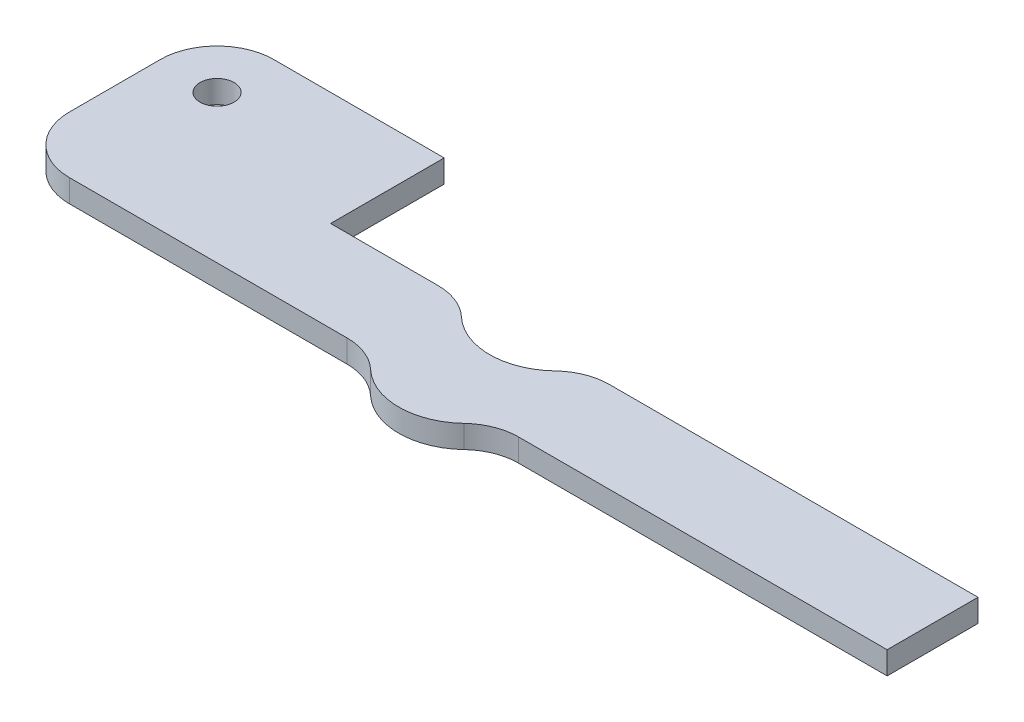
from build123d import *

# Parameters (mm, degrees)
SKETCH_1_R          = 1.5
EXTRUDE_1_DEPTH     = 2
FILLET_2_R          = 5
FILLET_3_R          = 5
SKETCH_7_R          = 6
CUT_EXTRUDE_4_DEPTH = 10
FILLET_5_R          = 5
SKETCH_10_W         = 10
SKETCH_10_H         = 2
EXTRUDE_4_DEPTH     = 10


with BuildPart() as part:
    # 草图1 → 凸台-拉伸1 (new body)
    with BuildSketch(Plane(origin=(0, 0, 0), x_dir=(1, 0, 0), z_dir=(0, 1, 0))):
        with BuildLine():
            Line((17.196152423, -13), (52, -13))
            Line((52, -13), (52, -5))
            Line((52, -5), (-15, -5))
            Line((-15, -5), (-15, 5))
            Line((-15, 5), (-25, 5))
            Line((-25, 5), (-25, -13))
            Line((-25, -13), (6.803847577, -13))
            ThreePointArc((6.803847577, -13), (12, -16), (17.196152423, -13))
        make_face()
        with Locations(Location((-20, 0, 0), (0, 0, 270))):
            Circle(SKETCH_1_R, mode=Mode.SUBTRACT)
    extrude(amount=EXTRUDE_1_DEPTH)

    # 圆角2
    fillet_2_edges = [part.edges().sort_by_distance(p)[0] for p in [
        (-25, 1, -5),
    ]]
    fillet(fillet_2_edges, radius=FILLET_2_R)

    # 圆角3
    fillet_3_edges = [part.edges().sort_by_distance(p)[0] for p in [
        (-25, 1, 13),
    ]]
    fillet(fillet_3_edges, radius=FILLET_3_R)

    # 草图7 → 切除-拉伸4 (cut)
    with BuildSketch(Plane(origin=(0, 2, 0), x_dir=(1, 0, 0), z_dir=(0, 1, 0))):
        with Locations((12, -2)):
            Circle(SKETCH_7_R)
    extrude(amount=-CUT_EXTRUDE_4_DEPTH, mode=Mode.SUBTRACT)

    # 圆角5
    fillet_5_edges = [part.edges().sort_by_distance(p)[0] for p in [
        (17.196152423, 1, 13),
        (6.803847577, 1, 13),
        (6.803847577, 1, 5),
        (17.196152423, 1, 5),
    ]]
    fillet(fillet_5_edges, radius=FILLET_5_R)

    # 草图10 → 凸台-拉伸4 (add)
    with BuildSketch(Plane(origin=(-15, 0, 0), x_dir=(0, 0, -1), z_dir=(1, 0, 0))):
        with Locations((0, 1)):
            Rectangle(SKETCH_10_W, SKETCH_10_H)
    extrude(amount=EXTRUDE_4_DEPTH)


solid = part.part
